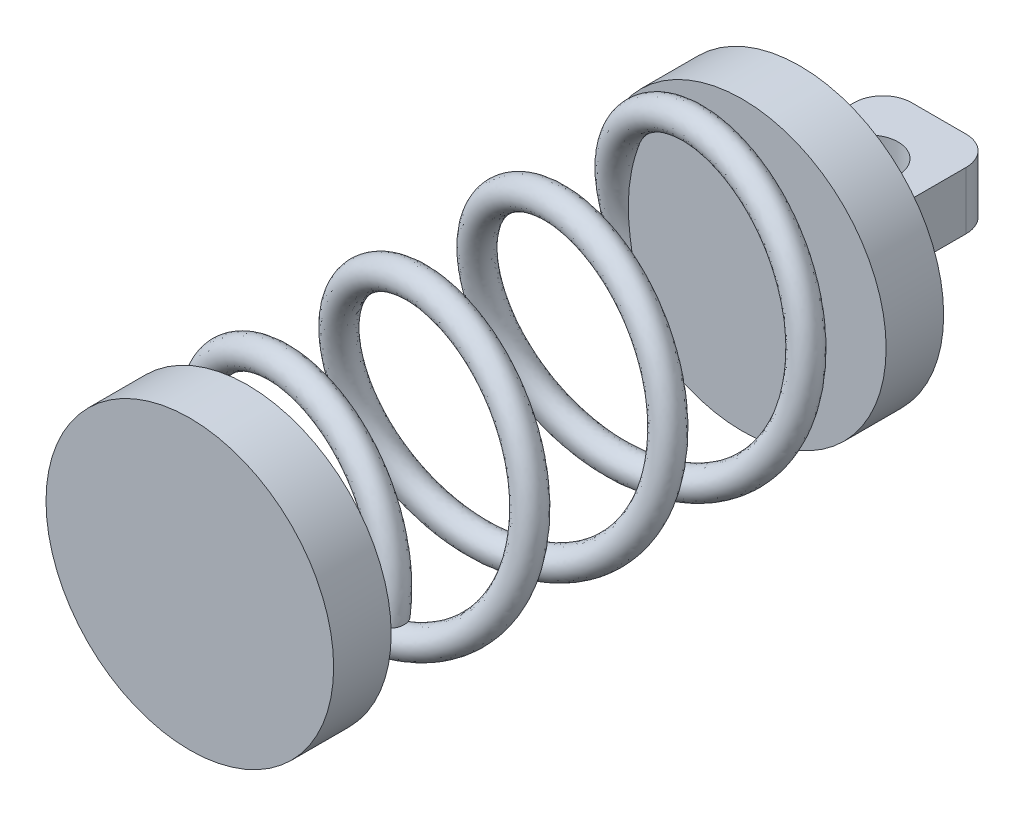
from build123d import *

# Parameters (mm, degrees)
SKETCH1_R           = 25
BOSS_EXTRUDE1_DEPTH = 10
SWEEP1_PITCH        = 24
SWEEP1_HEIGHT       = 90
SWEEP1_RADIUS       = 22.25
SWEEP1_START_ANGLE  = -180
SKETCH6_R           = 2.5
SKETCH8_R           = 25
BOSS_EXTRUDE2_DEPTH = 5
SKETCH9_R           = 5
BOSS_EXTRUDE3_DEPTH = 5


with BuildPart() as part:
    # Sketch1 → Boss-Extrude1 (new body)
    with BuildSketch(Plane.XY):
        Circle(SKETCH1_R)
    extrude(amount=BOSS_EXTRUDE1_DEPTH)


with BuildPart() as body_2:
    # Sweep1: sweep along a helix
    with BuildLine() as sweep1_path:
        add(Helix(SWEEP1_PITCH, SWEEP1_HEIGHT, SWEEP1_RADIUS, center=(0, 0, -2.5), direction=(0, 0, -1), lefthand=True, mode=Mode.PRIVATE).rotate(Axis((0, 0, -2.5), (0, 0, -1)), SWEEP1_START_ANGLE))
    # Sketch6 → Sweep1 (sweep)
    with BuildSketch(Plane(origin=(0, 0, 0), x_dir=(1, 0, 0), z_dir=(0, 1, 0))):
        with Locations((22.25, 2.5)):
            Circle(SKETCH6_R)
    sweep(path=sweep1_path.line, is_frenet=True)

    # Sketch8 → Boss-Extrude2 (add, symmetric)
    with BuildSketch(Plane(origin=(0, 0, -91.033627504), x_dir=(-1, 0, 0), z_dir=(0, 0, -1))):
        Circle(SKETCH8_R)
    extrude(amount=BOSS_EXTRUDE2_DEPTH, both=True)

    # Sketch9 → Boss-Extrude3 (add, symmetric)
    with BuildSketch(Plane(origin=(0, 0, 0), x_dir=(1, 0, 0), z_dir=(0, 1, 0))):
        with BuildLine():
            Line((4.737356354, 120.205088148), (-4.737356354, 120.205088148))
            ThreePointArc((-4.737356354, 120.205088148), (-8.27289026, 118.740622053), (-9.737356354, 115.205088148))
            Line((-9.737356354, 115.205088148), (-9.737356354, 96.033627504))
            Line((-9.737356354, 96.033627504), (9.737356354, 96.033627504))
            Line((9.737356354, 96.033627504), (9.737356354, 115.205088148))
            ThreePointArc((9.737356354, 115.205088148), (8.27289026, 118.740622053), (4.737356354, 120.205088148))
        make_face()
        with Locations(Location((0, 108.119357826, 0), (0, 0, 270))):
            Circle(SKETCH9_R, mode=Mode.SUBTRACT)
    extrude(amount=BOSS_EXTRUDE3_DEPTH, both=True)


solid = Compound([part.part, body_2.part])
